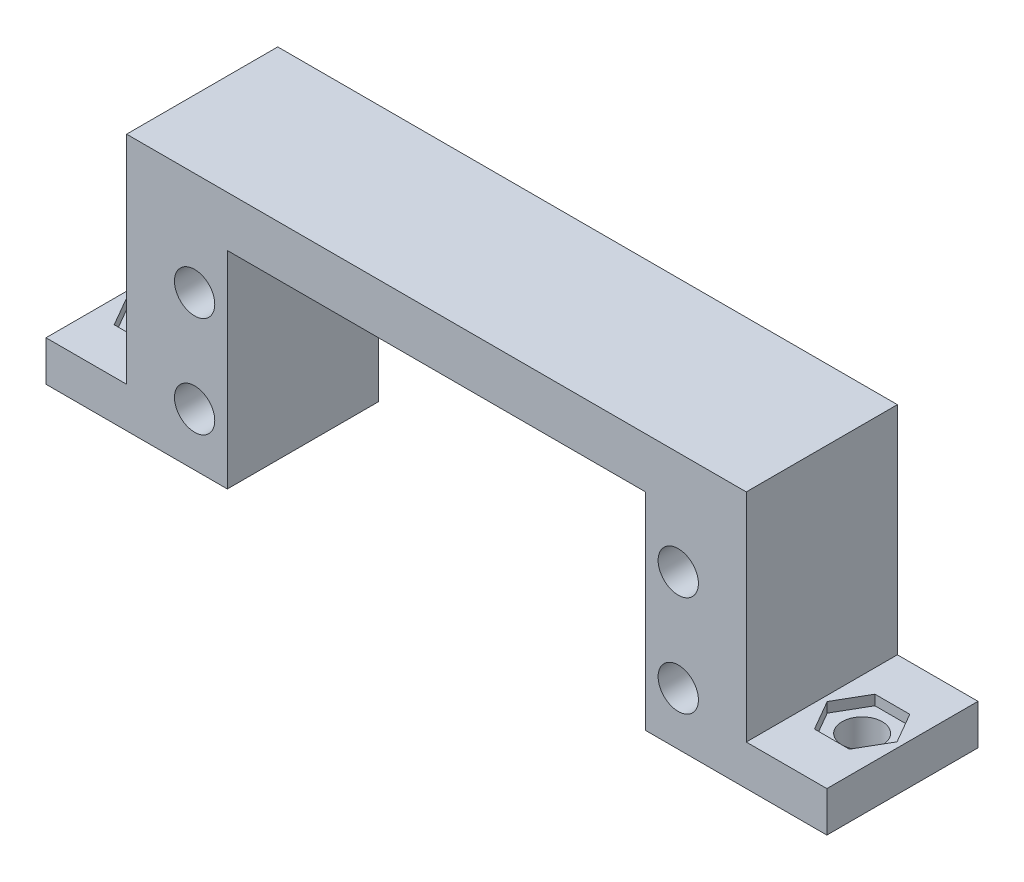
from build123d import *

# Parameters (mm, degrees)
SKETCH1_R           = 2
BOSS_EXTRUDE1_DEPTH = 15
CUT_EXTRUDE1_DEPTH  = 11
CUT_EXTRUDE2_DEPTH  = 1
SKETCH5_R           = 2
CUT_EXTRUDE3_DEPTH  = 4


with BuildPart() as part:
    # Sketch1 → Boss-Extrude1 (new body)
    with BuildSketch(Plane.XY):
        Polygon((0, 0), (0, 20.5), (41.5, 20.5), (41.5, 0), (59.5, 0), (59.5, 4), (51.5, 4), (51.5, 25.5), (-10, 25.5), (-10, 4), (-18, 4), (-18, 0), align=None)
        with Locations((44.75, 5.25)):
            Circle(SKETCH1_R, mode=Mode.SUBTRACT)
        with Locations((44.75, 15.25)):
            Circle(SKETCH1_R, mode=Mode.SUBTRACT)
        with Locations((-3.25, 15.25)):
            Circle(SKETCH1_R, mode=Mode.SUBTRACT)
        with Locations((-3.25, 5.25)):
            Circle(SKETCH1_R, mode=Mode.SUBTRACT)
    extrude(amount=BOSS_EXTRUDE1_DEPTH)

    # Sketch3 → Cut-Extrude1 (cut)
    with BuildSketch(Plane(origin=(0, 0, 0), x_dir=(-1, 0, 0), z_dir=(0, 0, -1))):
        Polygon((3.25, 18.714101615), (0.25, 16.982050808), (0.25, 13.517949192), (3.25, 11.785898385), (6.25, 13.517949192), (6.25, 16.982050808), align=None)
        Polygon((3.25, 8.714101615), (0.25, 6.982050808), (0.25, 3.517949192), (3.25, 1.785898385), (6.25, 3.517949192), (6.25, 6.982050808), align=None)
        Polygon((-44.75, 18.714101615), (-47.75, 16.982050808), (-47.75, 13.517949192), (-44.75, 11.785898385), (-41.75, 13.517949192), (-41.75, 16.982050808), align=None)
        Polygon((-45.037677981, 8.702135771), (-47.883476265, 6.726931446), (-47.595798284, 3.274795675), (-44.462322019, 1.797864229), (-41.616523735, 3.773068554), (-41.904201716, 7.225204325), align=None)
    extrude(amount=-CUT_EXTRUDE1_DEPTH, mode=Mode.SUBTRACT)

    # Sketch4 → Cut-Extrude2 (cut)
    with BuildSketch(Plane(origin=(0, 4, 0), x_dir=(1, 0, 0), z_dir=(0, 1, 0))):
        Polygon((58.964101615, -7.5), (57.232050808, -4.5), (53.767949192, -4.5), (52.035898385, -7.5), (53.767949192, -10.5), (57.232050808, -10.5), align=None)
        Polygon((-17.464101615, -7.5), (-15.732050808, -10.5), (-12.267949192, -10.5), (-10.535898385, -7.5), (-12.267949192, -4.5), (-15.732050808, -4.5), align=None)
    extrude(amount=-CUT_EXTRUDE2_DEPTH, mode=Mode.SUBTRACT)

    # Sketch5 → Cut-Extrude3 (cut)
    with BuildSketch(Plane(origin=(0, 4, 0), x_dir=(1, 0, 0), z_dir=(0, 1, 0))):
        with Locations(Location((55.5, -7.5, 0), (0, 0, 180))):
            Circle(SKETCH5_R)
        with Locations(Location((-14, -7.5, 0), (0, 0, 180))):
            Circle(SKETCH5_R)
    extrude(amount=-CUT_EXTRUDE3_DEPTH, mode=Mode.SUBTRACT)


solid = part.part
